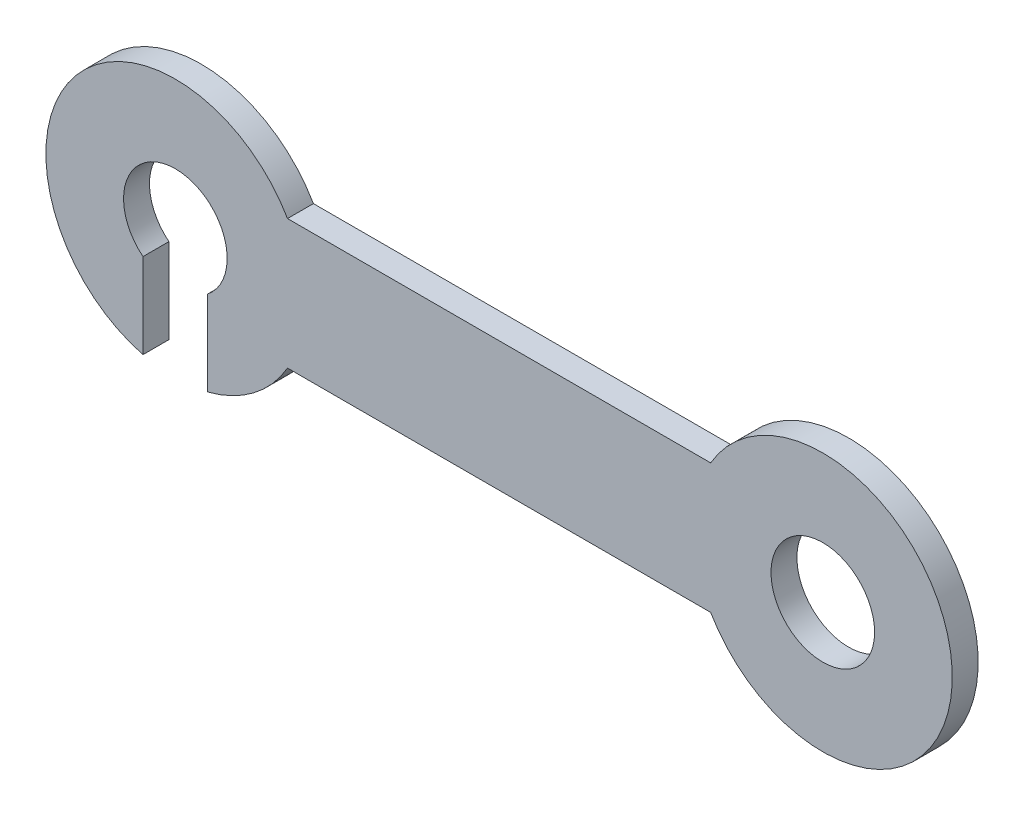
from build123d import *

# Parameters (mm, degrees)
SKETCH1_R           = 20
BOSS_EXTRUDE1_DEPTH = 4
BOSS_EXTRUDE2_DEPTH = 4
SKETCH4_R           = 8
CUT_EXTRUDE1_DEPTH  = 4
SKETCH5_W           = 10
SKETCH5_H           = 19.132811744
CUT_EXTRUDE3_DEPTH  = 4
SKETCH6_R           = 8
CUT_EXTRUDE4_DEPTH  = 4


with BuildPart() as part:
    # Sketch1 → Boss-Extrude1 (new body)
    with BuildSketch(Plane.XY):
        Circle(SKETCH1_R)
    extrude(amount=BOSS_EXTRUDE1_DEPTH)

    # Sketch3 → Boss-Extrude2 (add)
    with BuildSketch(Plane.XY):
        with BuildLine():
            ThreePointArc((120, 0), (105.176380902, 19.318516526), (82.679491924, 10))
            Line((82.679491924, 10), (100, 10))
            Line((100, 10), (100, 0))
            Line((100, 0), (100, -10))
            Line((100, -10), (82.679491924, -10))
            ThreePointArc((82.679491924, -10), (105.176380902, -19.318516526), (120, 0))
        make_face()
        with BuildLine():
            Line((100, 10), (82.679491924, 10))
            ThreePointArc((82.679491924, 10), (80, 0), (82.679491924, -10))
            Line((82.679491924, -10), (100, -10))
            Line((100, -10), (100, 0))
            Line((100, 0), (100, 10))
        make_face()
        with BuildLine():
            Line((82.679491924, 10), (0, 10))
            Line((0, 10), (0, 0))
            Line((0, 0), (0, -10))
            Line((0, -10), (82.679491924, -10))
            ThreePointArc((82.679491924, -10), (80, 0), (82.679491924, 10))
        make_face()
    extrude(amount=BOSS_EXTRUDE2_DEPTH)

    # Sketch4 → Cut-Extrude1 (cut)
    with BuildSketch(Plane.XY):
        Circle(SKETCH4_R)
    extrude(amount=CUT_EXTRUDE1_DEPTH, mode=Mode.SUBTRACT)

    # Sketch5 → Cut-Extrude3 (cut)
    with BuildSketch(Plane.XY):
        with Locations((0, -14.406019059)):
            Rectangle(SKETCH5_W, SKETCH5_H)
    extrude(amount=CUT_EXTRUDE3_DEPTH, mode=Mode.SUBTRACT)

    # Sketch6 → Cut-Extrude4 (cut)
    with BuildSketch(Plane.XY):
        with Locations((100, 0)):
            Circle(SKETCH6_R)
    extrude(amount=CUT_EXTRUDE4_DEPTH, mode=Mode.SUBTRACT)


solid = part.part
